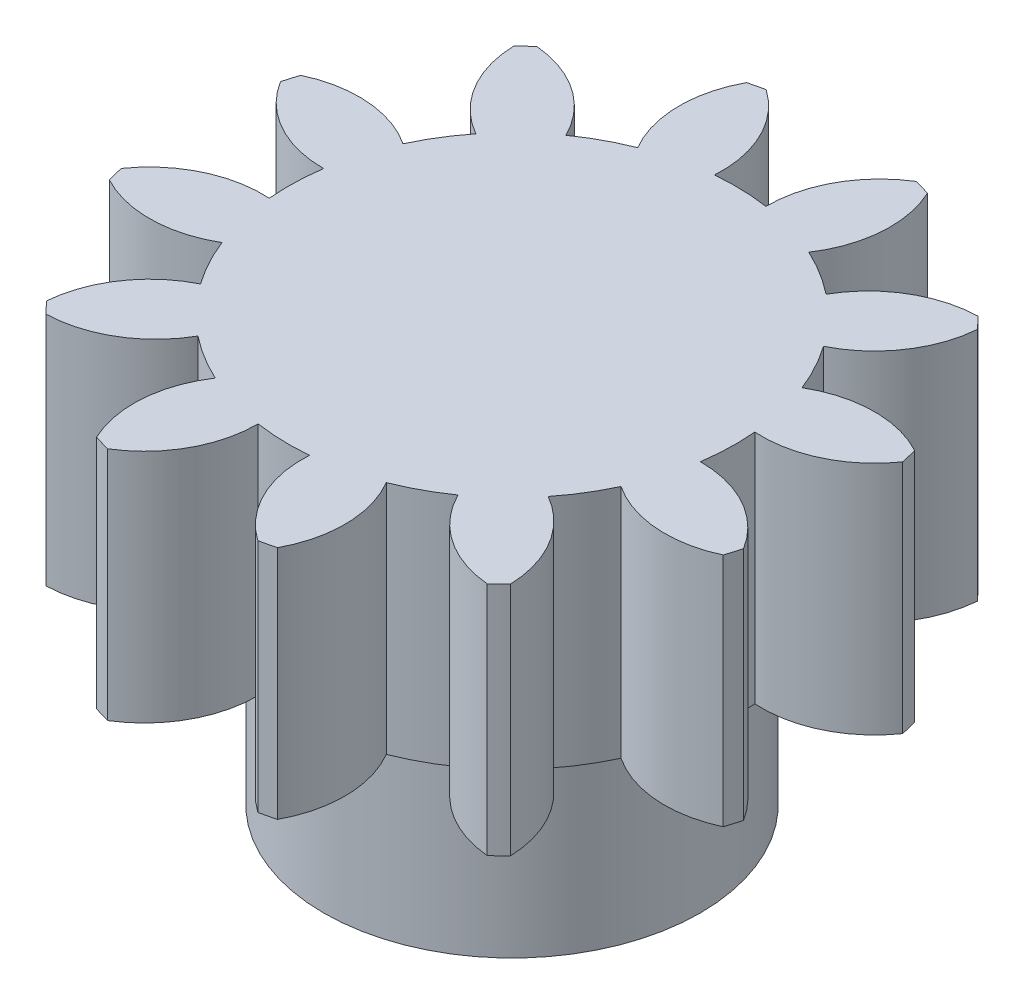
from build123d import *

# Parameters (mm, degrees)
SKETCH1_R           = 4
BOSS_EXTRUDE1_DEPTH = 5
BOSS_EXTRUDE2_START = -9
SKETCH2_R           = 4
BOSS_EXTRUDE2_DEPTH = 9


with BuildPart() as part:
    # Sketch1 → Boss-Extrude1 (new body)
    with BuildSketch(Plane.XZ.offset(5)):
        with BuildLine():
            ThreePointArc((0.852350502, 5.046340911), (-0.292914214, 4.63874602), (-1.091544478, 3.722255668))
            ThreePointArc((-1.091544478, 3.722255668), (-1.570358996, 4.018783876), (-2.080910718, 4.256542705))
            ThreePointArc((-2.080910718, 4.256542705), (-1.75253572, 5.426984811), (-2.039802025, 6.60818883))
            ThreePointArc((-2.039802025, 6.60818883), (-2.208224588, 6.650434309), (-2.377643182, 6.68848927))
            ThreePointArc((-2.377643182, 6.68848927), (-3.165674074, 5.762869382), (-3.399062995, 4.569850323))
            ThreePointArc((-3.399062995, 4.569850323), (-3.961992636, 4.587244025), (-4.523022811, 4.537873349))
            ThreePointArc((-4.523022811, 4.537873349), (-4.823862774, 5.715693447), (-5.663244701, 6.595012981))
            ThreePointArc((-5.663244701, 6.595012981), (-5.830225658, 6.547387358), (-5.995973945, 6.495634624))
            ThreePointArc((-5.995973945, 6.495634624), (-6.215618773, 5.300008841), (-5.821229978, 4.150129568))
            ThreePointArc((-5.821229978, 4.150129568), (-6.317438198, 3.883728135), (-6.778619245, 3.560456788))
            ThreePointArc((-6.778619245, 3.560456788), (-7.628064343, 4.430058932), (-8.794650183, 4.771881024))
            ThreePointArc((-8.794650183, 4.771881024), (-8.915447123, 4.647145545), (-9.033112983, 4.51945222))
            ThreePointArc((-9.033112983, 4.51945222), (-8.625518092, 3.374187504), (-7.709027739, 2.57555724))
            ThreePointArc((-7.709027739, 2.57555724), (-8.005555948, 2.096742722), (-8.243314776, 1.586191))
            ThreePointArc((-8.243314776, 1.586191), (-9.413756883, 1.914565998), (-10.594960902, 1.627299693))
            ThreePointArc((-10.594960902, 1.627299693), (-10.63720638, 1.45887713), (-10.675261342, 1.289458536))
            ThreePointArc((-10.675261342, 1.289458536), (-9.749641454, 0.501427644), (-8.556622395, 0.268038723))
            ThreePointArc((-8.556622395, 0.268038723), (-8.574016096, -0.294890918), (-8.524645421, -0.855921093))
            ThreePointArc((-8.524645421, -0.855921093), (-9.702465518, -1.156761056), (-10.581785053, -1.996142983))
            ThreePointArc((-10.581785053, -1.996142983), (-10.53415943, -2.16312394), (-10.482406696, -2.328872227))
            ThreePointArc((-10.482406696, -2.328872227), (-9.286780912, -2.548517055), (-8.136901639, -2.15412826))
            ThreePointArc((-8.136901639, -2.15412826), (-7.870500207, -2.65033648), (-7.54722886, -3.111517527))
            ThreePointArc((-7.54722886, -3.111517527), (-8.416831004, -3.960962625), (-8.758653095, -5.127548465))
            ThreePointArc((-8.758653095, -5.127548465), (-8.633917617, -5.248345404), (-8.506224291, -5.366011265))
            ThreePointArc((-8.506224291, -5.366011265), (-7.360959576, -4.958416374), (-6.562329312, -4.041926021))
            ThreePointArc((-6.562329312, -4.041926021), (-6.083514793, -4.33845423), (-5.572963071, -4.576213058))
            ThreePointArc((-5.572963071, -4.576213058), (-5.90133807, -5.746655165), (-5.614071764, -6.927859184))
            ThreePointArc((-5.614071764, -6.927859184), (-5.445649202, -6.970104662), (-5.276230608, -7.008159624))
            ThreePointArc((-5.276230608, -7.008159624), (-4.488199715, -6.082539736), (-4.254810795, -4.889520676))
            ThreePointArc((-4.254810795, -4.889520676), (-3.691881154, -4.906914378), (-3.130850979, -4.857543703))
            ThreePointArc((-3.130850979, -4.857543703), (-2.830011016, -6.0353638), (-1.990629088, -6.914683335))
            ThreePointArc((-1.990629088, -6.914683335), (-1.823648131, -6.867057711), (-1.657899844, -6.815304978))
            ThreePointArc((-1.657899844, -6.815304978), (-1.438255016, -5.619679194), (-1.832643812, -4.469799921))
            ThreePointArc((-1.832643812, -4.469799921), (-1.336435592, -4.203398489), (-0.875254545, -3.880127142))
            ThreePointArc((-0.875254545, -3.880127142), (-0.025809446, -4.749729286), (1.140776394, -5.091551377))
            ThreePointArc((1.140776394, -5.091551377), (1.261573333, -4.966815899), (1.379239193, -4.839122573))
            ThreePointArc((1.379239193, -4.839122573), (0.971644302, -3.693857858), (0.05515395, -2.895227594))
            ThreePointArc((0.05515395, -2.895227594), (0.351682158, -2.416413075), (0.589440987, -1.905861353))
            ThreePointArc((0.589440987, -1.905861353), (1.759883093, -2.234236352), (2.941087112, -1.946970046))
            ThreePointArc((2.941087112, -1.946970046), (2.983332591, -1.778547484), (3.021387552, -1.60912889))
            ThreePointArc((3.021387552, -1.60912889), (2.095767664, -0.821097997), (0.902748605, -0.587709077))
            ThreePointArc((0.902748605, -0.587709077), (0.920142307, -0.024779436), (0.870771631, 0.536250739))
            ThreePointArc((0.870771631, 0.536250739), (2.048591729, 0.837090702), (2.927911263, 1.67647263))
            ThreePointArc((2.927911263, 1.67647263), (2.88028564, 1.843453587), (2.828532906, 2.009201874))
            ThreePointArc((2.828532906, 2.009201874), (1.632907123, 2.228846702), (0.48302785, 1.834457906))
            ThreePointArc((0.48302785, 1.834457906), (0.216626417, 2.330666127), (-0.10664493, 2.791847173))
            ThreePointArc((-0.10664493, 2.791847173), (0.762957214, 3.641292272), (1.104779306, 4.807878112))
            ThreePointArc((1.104779306, 4.807878112), (0.980043827, 4.928675051), (0.852350502, 5.046340911))
        make_face()
        with Locations(Location((-3.826936895, -0.159835177, 0), (0, 0, 180))):
            Circle(SKETCH1_R, mode=Mode.SUBTRACT)
    extrude(amount=-BOSS_EXTRUDE1_DEPTH)

    # Sketch2 → Boss-Extrude2 (add)
    with BuildSketch(Plane(origin=(0, 0, 0), x_dir=(1, 0, 0), z_dir=(0, 1, 0)).offset(BOSS_EXTRUDE2_START)):
        with Locations(Location((-3.826936895, 0.159835177, 0), (0, 0, 180))):
            Circle(SKETCH2_R)
    extrude(amount=BOSS_EXTRUDE2_DEPTH)


solid = part.part
